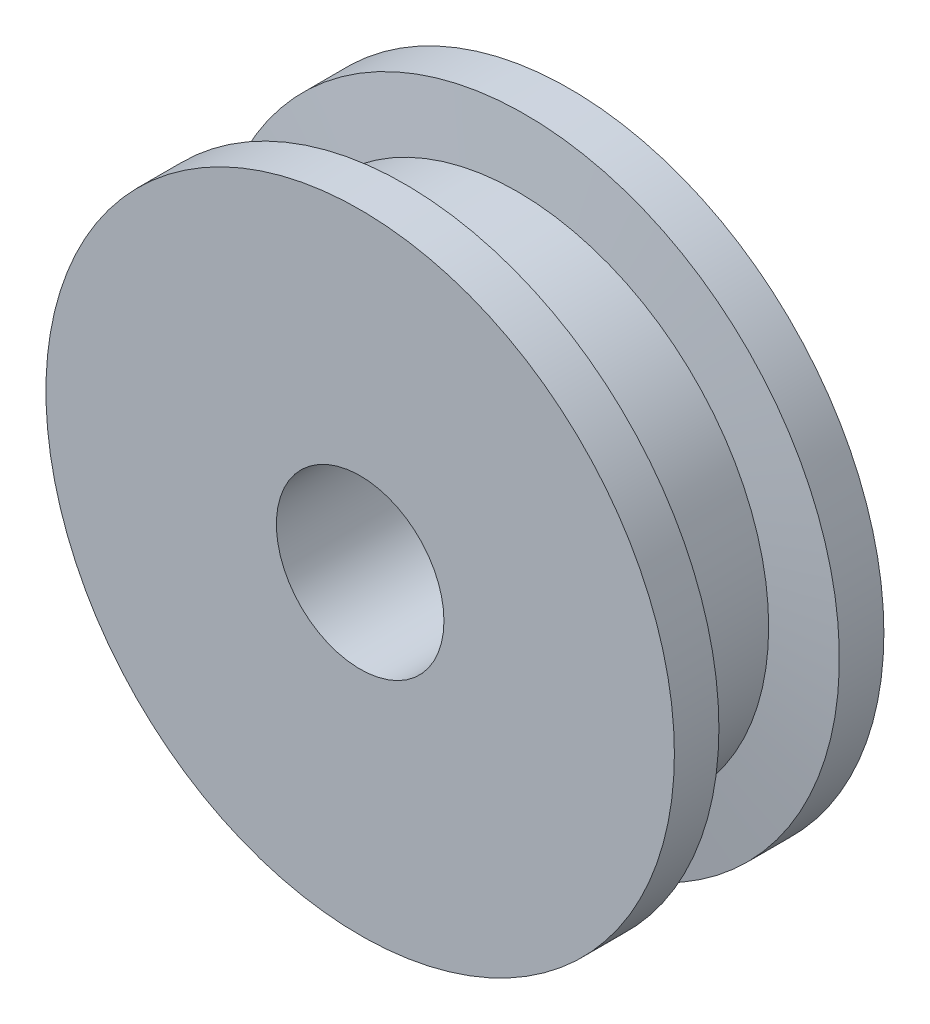
from build123d import *

# Parameters (mm, degrees)
SKETCH_1_R          = 15
EXTRUDE_1_DEPTH     = 10
SKETCH_4_R          = 4
CUT_EXTRUDE_1_DEPTH = 24.452078799


with BuildPart() as part:
    # 草图1 → 凸台-拉伸1 (new body)
    with BuildSketch(Plane.XY):
        Circle(SKETCH_1_R)
    extrude(amount=EXTRUDE_1_DEPTH)

    # 草图3 → 切除-旋转2 (revolve, cut)
    with BuildSketch(Plane(origin=(0, 0, 0), x_dir=(1, 0, 0), z_dir=(0, 1, 0)), mode=Mode.PRIVATE) as cut_revolve_2_sk:
        Polygon((-16, -2), (-12, -2.5), (-12, -7.5), (-16, -8), align=None)
    revolve(cut_revolve_2_sk.sketch.rotate(Axis((0, 0, 10), (0, 0, -1)), 180), axis=Axis((0, 0, 10), (0, 0, -1)), mode=Mode.SUBTRACT)

    # 草图4 → 切除-拉伸1 (cut, through all)
    with BuildSketch(Plane.XY.offset(10)):
        Circle(SKETCH_4_R)
    extrude(amount=-CUT_EXTRUDE_1_DEPTH, mode=Mode.SUBTRACT)


solid = part.part
